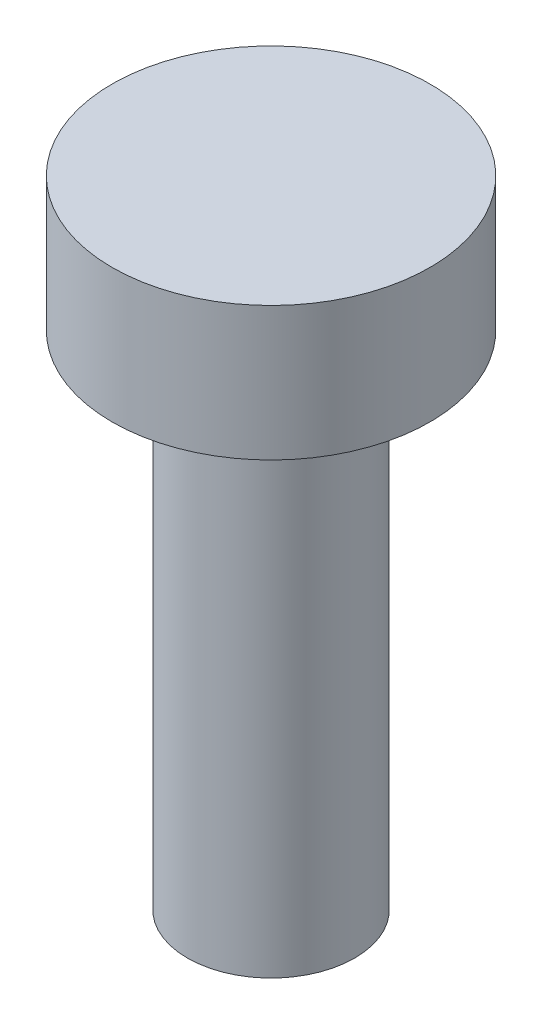
from build123d import *

# Parameters (mm, degrees)
SKETCH1_R   = 1.9
HEAD_DEPTH  = 1.6
SHANK_START = -6
SKETCH2_R   = 1
SHANK_DEPTH = 6


with BuildPart() as part:
    # Sketch1 → Head (new body)
    with BuildSketch(Plane(origin=(0, 0, 0), x_dir=(1, 0, 0), z_dir=(0, 1, 0))):
        with Locations(Location((0, 0, 0), (0, 0, 270))):
            Circle(SKETCH1_R)
    extrude(amount=HEAD_DEPTH)

    # Sketch2 → Shank (add)
    with BuildSketch(Plane(origin=(0, 0, 0), x_dir=(1, 0, 0), z_dir=(0, 1, 0)).offset(SHANK_START)):
        with Locations(Location((0, 0, 0), (0, 0, 270))):
            Circle(SKETCH2_R)
    extrude(amount=SHANK_DEPTH)


solid = part.part
